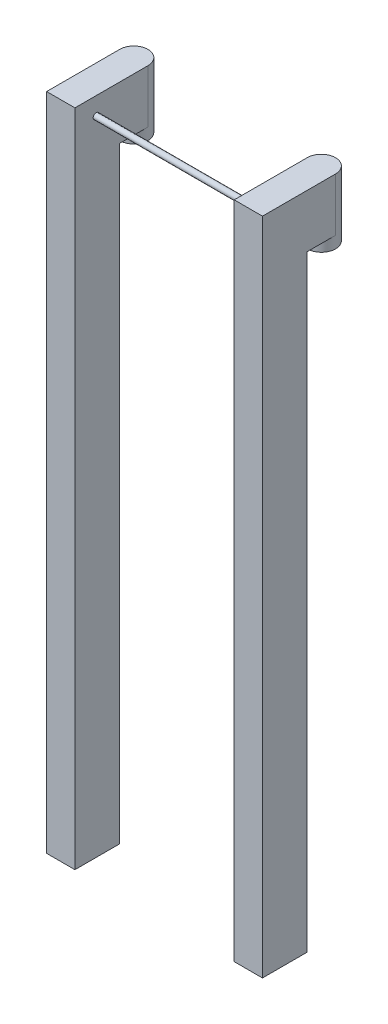
from build123d import *

# Parameters (mm, degrees)
SKETCH1_R             = 60
SKETCH1_R_2           = 32.528667591
BOSS_EXTRUDE1_DEPTH   = 50
SKETCH1_R_3           = 31.696746535
BOSS_EXTRUDE1_2_DEPTH = 50
SKETCH2_R             = 60
BOSS_EXTRUDE2_DEPTH   = 225.5
SKETCH5_W             = 120
SKETCH5_H             = 225.5
BOSS_EXTRUDE3_DEPTH   = 310
SKETCH6_W             = 120
SKETCH6_H             = 190
BOSS_EXTRUDE4_DEPTH   = 2574.5
SKETCH7_W             = 190
SKETCH7_H             = 225.5
BOSS_EXTRUDE5_DEPTH   = 676
SKETCH9_W             = 190
SKETCH9_H             = 225.5
SKETCH9_R             = 12.5
CUT_EXTRUDE1_DEPTH    = 676


with BuildPart() as part:
    # Sketch1 → Boss-Extrude1 (new body)
    with BuildSketch(Plane(origin=(0, 0, 0), x_dir=(1, 0, 0), z_dir=(0, 1, 0))):
        with Locations(Location((-398, 0, 0), (0, 0, 270))):
            Circle(SKETCH1_R)
        with Locations(Location((-398, 0, 0), (0, 0, 270))):
            Circle(SKETCH1_R_2, mode=Mode.SUBTRACT)
    extrude(amount=BOSS_EXTRUDE1_DEPTH)



with BuildPart() as body_2:
    # Sketch1 → Boss-Extrude1 2 (new body)
    with BuildSketch(Plane(origin=(0, 0, 0), x_dir=(1, 0, 0), z_dir=(0, 1, 0))):
        with Locations(Location((398, 0, 0), (0, 0, 270))):
            Circle(SKETCH1_R)
        with Locations(Location((398, 0, 0), (0, 0, 270))):
            Circle(SKETCH1_R_3, mode=Mode.SUBTRACT)
    extrude(amount=BOSS_EXTRUDE1_2_DEPTH)


with BuildPart() as part_1:
    add(part.part)

    add(body_2.part)  # Boss-Extrude2 merges body 2
    # Sketch2 → Boss-Extrude2 (add)
    with BuildSketch(Plane(origin=(0, 50, 0), x_dir=(1, 0, 0), z_dir=(0, 1, 0))):
        with Locations(Location((398, 0, 0), (0, 0, 270))):
            Circle(SKETCH2_R)
        with Locations(Location((-398, 0, 0), (0, 0, 270))):
            Circle(SKETCH2_R)
    extrude(amount=BOSS_EXTRUDE2_DEPTH)

    # Sketch5 → Boss-Extrude3 (add)
    with BuildSketch(Plane.XY):
        with Locations((-398, 162.75)):
            Rectangle(SKETCH5_W, SKETCH5_H)
        with Locations((398, 162.75)):
            Rectangle(SKETCH5_W, SKETCH5_H)
    extrude(amount=BOSS_EXTRUDE3_DEPTH)

    # Sketch6 → Boss-Extrude4 (add)
    with BuildSketch(Plane.XZ.offset(-50)):
        with Locations((398, 215)):
            Rectangle(SKETCH6_W, SKETCH6_H)
        with Locations((-398, 215)):
            Rectangle(SKETCH6_W, SKETCH6_H)
    extrude(amount=BOSS_EXTRUDE4_DEPTH)

    # Sketch7 → Boss-Extrude5 (add)
    with BuildSketch(Plane(origin=(-338, 0, 0), x_dir=(0, 0, -1), z_dir=(1, 0, 0))):
        with Locations((-215, 162.75)):
            Rectangle(SKETCH7_W, SKETCH7_H)
    extrude(amount=BOSS_EXTRUDE5_DEPTH)

    # Sketch9 → Cut-Extrude1 (cut)
    with BuildSketch(Plane.ZY.offset(-338)):
        with Locations((215, 162.75)):
            Rectangle(SKETCH9_W, SKETCH9_H)
        with Locations((220, 200.5)):
            Circle(SKETCH9_R, mode=Mode.SUBTRACT)
    extrude(amount=CUT_EXTRUDE1_DEPTH, mode=Mode.SUBTRACT)


solid = part_1.part
